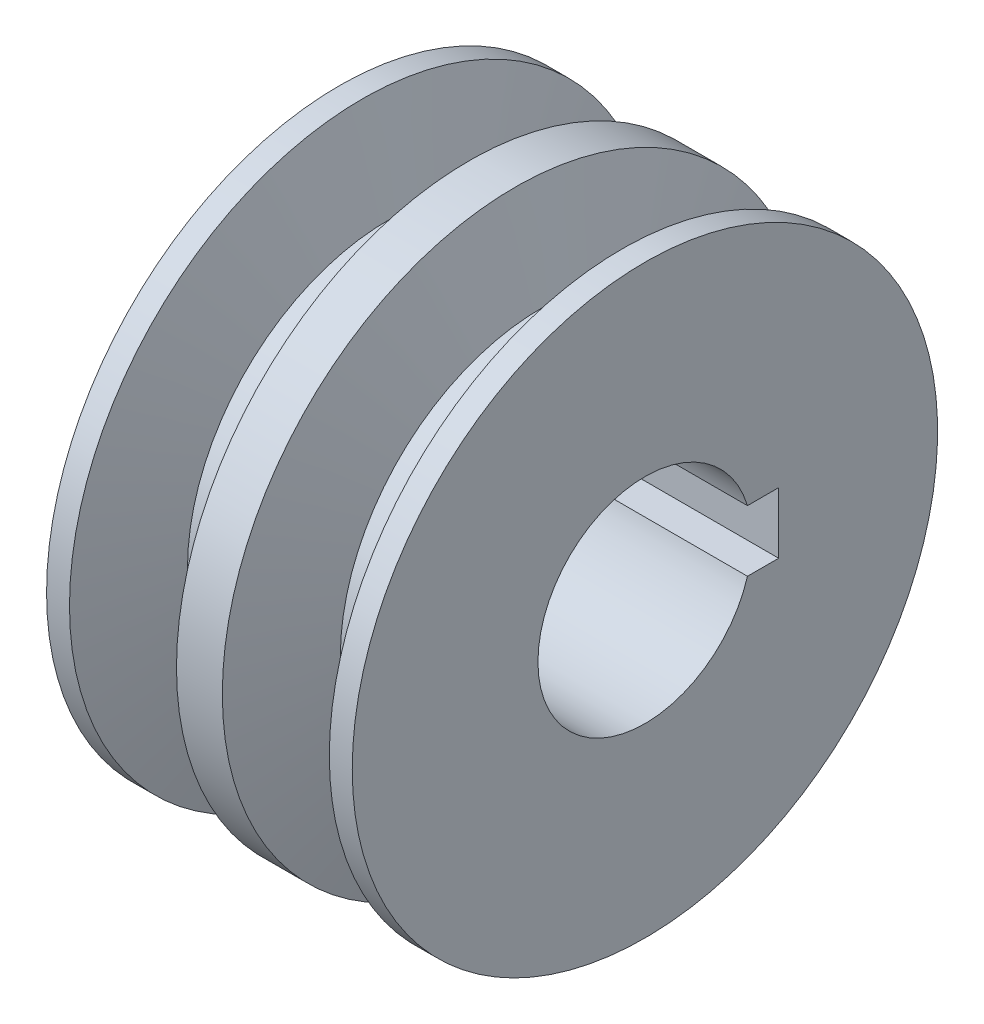
from build123d import *

# Parameters (mm, degrees)
KES_EKSTR_ZYON1_DEPTH = 457.345778602
IZIM3_R               = 14
KES_EKSTR_ZYON2_DEPTH = 40
KES_EKSTR_ZYON3_DEPTH = 40


with BuildPart() as part:
    # Çizim1 → Döndür1 (revolve)
    with BuildSketch(Plane(origin=(0, 0, 414.673045167), x_dir=(-1, 0, 0), z_dir=(0, 0, -1)), mode=Mode.PRIVATE) as d_nd_r1_sk:
        Polygon((-985.254127108, 38.3), (-985.254127108, 0), (-945.254127108, 0), (-945.254127108, 38.3), (-948.254127108, 38.3), (-951.695071737, 26.3), (-958.813182479, 26.3), (-962.254127108, 38.3), (-968.254127108, 38.3), (-971.695071737, 26.3), (-978.813182479, 26.3), (-982.254127108, 38.3), align=None)
    revolve(d_nd_r1_sk.sketch.rotate(Axis((985.254127108, 0, 414.673045167), (-1, 0, 0)), 270), axis=Axis((985.254127108, 0, 414.673045167), (-1, 0, 0)))

    # Çizim2 → Kes-Ekstrüzyon1 (cut, through all)
    with BuildSketch(Plane.ZY.offset(-945.254127108)):
        with BuildLine():
            Line((405.659166978, 3), (402.173045167, 3))
            Line((402.173045167, 3), (402.173045167, -3))
            Line((402.173045167, -3), (405.659166978, -3))
            ThreePointArc((405.659166978, -3), (424.173045167, 0), (405.659166978, 3))
        make_face()
    extrude(amount=-KES_EKSTR_ZYON1_DEPTH, mode=Mode.SUBTRACT)

    # Çizim3 → Kes-Ekstrüzyon2 (cut)
    with BuildSketch(Plane(origin=(985.254127108, 0, 0), x_dir=(0, 0, -1), z_dir=(1, 0, 0))):
        with Locations((-414.673045167, 0)):
            Circle(IZIM3_R)
    extrude(amount=-KES_EKSTR_ZYON2_DEPTH, mode=Mode.SUBTRACT)

    # Çizim4 → Kes-Ekstrüzyon3 (cut)
    with BuildSketch(Plane(origin=(985.254127108, 0, 0), x_dir=(0, 0, -1), z_dir=(1, 0, 0))):
        Polygon((-400.673045167, 4), (-400.673045167, 0), (-400.673045167, -4), (-397.173045167, -4), (-397.173045167, 4), align=None)
        with BuildLine():
            ThreePointArc((-401.256637302, 4), (-400.819711451, 2.02117415), (-400.673045167, 0))
            Line((-400.673045167, 0), (-400.673045167, 4))
            Line((-400.673045167, 4), (-401.256637302, 4))
        make_face()
        with BuildLine():
            Line((-400.673045167, -4), (-400.673045167, 0))
            ThreePointArc((-400.673045167, 0), (-400.819711451, -2.02117415), (-401.256637302, -4))
            Line((-401.256637302, -4), (-400.673045167, -4))
        make_face()
    extrude(amount=-KES_EKSTR_ZYON3_DEPTH, mode=Mode.SUBTRACT)


solid = part.part
